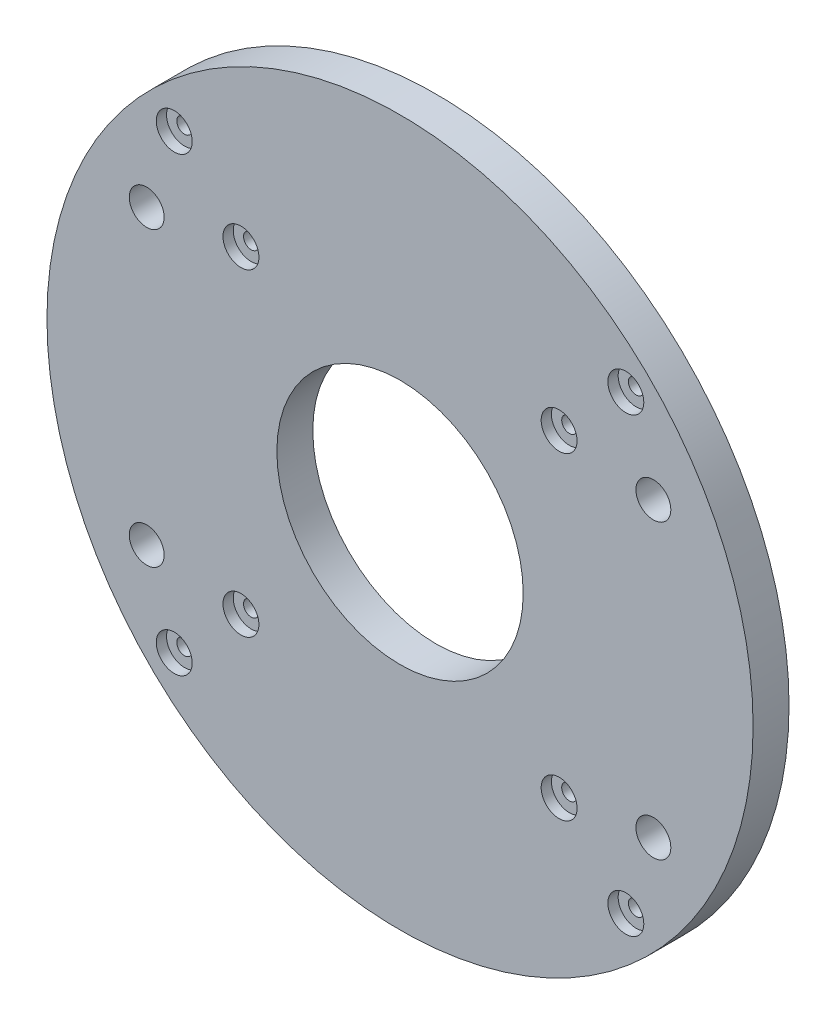
from build123d import *
from build123d.topology import SkipClean

# Parameters (mm, degrees)
EXTRUDE_1_DEPTH     = 3.5
EXTRUDE_START       = 3
SKETCH_2_R          = 1.7
EXTRUDE_2_DEPTH     = 3
SKETCH_3_R          = 0.75
CUT_EXTRUDE_1_DEPTH = 88.945086175
SKETCH_4_R          = 12
CUT_EXTRUDE_2_DEPTH = 88.945086175
CUT_EXTRUDE_START   = -1
SKETCH_5_R          = 1.75
SKETCH_5_R_2        = 0.75
CUT_EXTRUDE_4_DEPTH = 1
SKETCH_6_W          = 3
SKETCH_6_H          = 50
CUT_EXTRUDE_5_DEPTH = 100.398968375


with BuildPart() as part:
    # 草图1 → 凸台-拉伸1 (new body)
    with BuildSketch(Plane.XY):
        with BuildLine():
            ThreePointArc((31.968716166, 26.753538627), (7.644242894, 16.6780119), (-2.431283834, -7.646461373))
            ThreePointArc((-2.431283834, -7.646461373), (31.968716166, -42.046461373), (66.368716166, -7.646461373))
            ThreePointArc((66.368716166, -7.646461373), (56.293189439, 16.6780119), (31.968716166, 26.753538627))
        make_face()
        with BuildLine():
            ThreePointArc((7.286992159, 4.903538627), (8.986992159, 6.603538627), (7.286992159, 8.303538627))
            ThreePointArc((7.286992159, 8.303538627), (5.586992159, 6.603538627), (7.286992159, 4.903538627))
        make_face(mode=Mode.SUBTRACT)
        with BuildLine():
            ThreePointArc((56.650440174, 8.303538627), (54.950440174, 6.603538627), (56.650440174, 4.903538627))
            ThreePointArc((56.650440174, 4.903538627), (58.350440174, 6.603538627), (56.650440174, 8.303538627))
        make_face(mode=Mode.SUBTRACT)
        with BuildLine():
            ThreePointArc((7.286992159, -23.596461373), (8.986992159, -21.896461373), (7.286992159, -20.196461373))
            ThreePointArc((7.286992159, -20.196461373), (5.586992159, -21.896461373), (7.286992159, -23.596461373))
        make_face(mode=Mode.SUBTRACT)
        with BuildLine():
            ThreePointArc((56.650440174, -20.196461373), (54.950440174, -21.896461373), (56.650440174, -23.596461373))
            ThreePointArc((56.650440174, -23.596461373), (58.350440174, -21.896461373), (56.650440174, -20.196461373))
        make_face(mode=Mode.SUBTRACT)
    extrude(amount=EXTRUDE_1_DEPTH)

    # 草图2 → 凸台-拉伸2 (add)
    # profile 1 of 3: a face of its own
    with SkipClean():  # the faces are left unmerged after this step: merging them gives an invalid solid
        with BuildSketch(Plane(origin=(0, 0, 0), x_dir=(-1, 0, 0), z_dir=(0, 0, -1)).offset(EXTRUDE_START)):
            with BuildLine():
                ThreePointArc((-55.598358567, 17.353538627), (-66.368716166, -7.646461373), (-55.598358567, -32.646461373))
                Line((-55.598358567, -32.646461373), (-8.339073765, -32.646461373))
                ThreePointArc((-8.339073765, -32.646461373), (-0.375839607, -21.257124498), (2.431283834, -7.646461373))
                ThreePointArc((2.431283834, -7.646461373), (-0.375839607, 5.964201752), (-8.339073765, 17.353538627))
                Line((-8.339073765, 17.353538627), (-55.598358567, 17.353538627))
            make_face()
            with Locations((-56.650440174, -21.896461373)):
                Circle(SKETCH_2_R, mode=Mode.SUBTRACT)
            with Locations((-7.286992159, -21.896461373)):
                Circle(SKETCH_2_R, mode=Mode.SUBTRACT)
            with Locations((-56.650440174, 6.603538627)):
                Circle(SKETCH_2_R, mode=Mode.SUBTRACT)
            with Locations((-7.286992159, 6.603538627)):
                Circle(SKETCH_2_R, mode=Mode.SUBTRACT)
        # profile 2 of 3: a face of its own
        with BuildSketch(Plane(origin=(0, 0, 0), x_dir=(-1, 0, 0), z_dir=(0, 0, -1)).offset(EXTRUDE_START)):
            with BuildLine():
                Line((-76.968716166, 17.353538627), (-76.968716166, -32.646461373))
                Line((-76.968716166, -32.646461373), (-55.598358567, -32.646461373))
                ThreePointArc((-55.598358567, -32.646461373), (-66.368716166, -7.646461373), (-55.598358567, 17.353538627))
                Line((-55.598358567, 17.353538627), (-76.968716166, 17.353538627))
            make_face()
        # profile 3 of 3: a face of its own
        with BuildSketch(Plane(origin=(0, 0, 0), x_dir=(-1, 0, 0), z_dir=(0, 0, -1)).offset(EXTRUDE_START)):
            with BuildLine():
                ThreePointArc((2.431283834, -7.646461373), (-0.375839607, -21.257124498), (-8.339073765, -32.646461373))
                Line((-8.339073765, -32.646461373), (13.031283834, -32.646461373))
                Line((13.031283834, -32.646461373), (13.031283834, 17.353538627))
                Line((13.031283834, 17.353538627), (-8.339073765, 17.353538627))
                ThreePointArc((-8.339073765, 17.353538627), (-0.375839607, 5.964201752), (2.431283834, -7.646461373))
            make_face()
        extrude(amount=-EXTRUDE_2_DEPTH)

    # 草图3 → 切除-拉伸1 (cut, through all)
    with SkipClean():  # the faces are left unmerged after this step: merging them gives an invalid solid
        with BuildSketch(Plane(origin=(0, 0, -3), x_dir=(-1, 0, 0), z_dir=(0, 0, -1))):
            with Locations((-47.468716166, 7.853538627)):
                Circle(SKETCH_3_R)
            with Locations(Location((-47.468716166, -23.146461373, 0), (0, 0, 180))):
                Circle(SKETCH_3_R)
            with Locations(Location((-16.468716166, 7.853538627, 0), (0, 0, 180))):
                Circle(SKETCH_3_R)
            with Locations((-16.468716166, -23.146461373)):
                Circle(SKETCH_3_R)
            with Locations((-53.968716166, 14.353538627)):
                Circle(SKETCH_3_R)
            with Locations(Location((-53.968716166, -29.646461373, 0), (0, 0, 180))):
                Circle(SKETCH_3_R)
            with Locations((-9.968716166, -29.646461373)):
                Circle(SKETCH_3_R)
            with Locations(Location((-9.968716166, 14.353538627, 0), (0, 0, 180))):
                Circle(SKETCH_3_R)
        extrude(amount=-CUT_EXTRUDE_1_DEPTH, mode=Mode.SUBTRACT)

    # 草图4 → 切除-拉伸2 (cut, through all)
    with SkipClean():  # the faces are left unmerged after this step: merging them gives an invalid solid
        with BuildSketch(Plane.XY.offset(3.5)):
            with Locations((31.968716166, -7.646461373)):
                Circle(SKETCH_4_R)
        extrude(amount=-CUT_EXTRUDE_2_DEPTH, mode=Mode.SUBTRACT)

    # 草图5 → 切除-拉伸4 (cut)
    # profile 1 of 8: a face of its own
    with SkipClean():  # the faces are left unmerged after this step: merging them gives an invalid solid
        with BuildSketch(Plane.XY.offset(3.5).offset(CUT_EXTRUDE_START)):
            with Locations((9.968716166, 14.353538627)):
                Circle(SKETCH_5_R)
            with Locations((9.968716166, 14.353538627)):
                Circle(SKETCH_5_R_2, mode=Mode.SUBTRACT)
        # profile 2 of 8: a face of its own
        with BuildSketch(Plane.XY.offset(3.5).offset(CUT_EXTRUDE_START)):
            with Locations((16.468716166, 7.853538627)):
                Circle(SKETCH_5_R)
            with Locations((16.468716166, 7.853538627)):
                Circle(SKETCH_5_R_2, mode=Mode.SUBTRACT)
        # profile 3 of 8: a face of its own
        with BuildSketch(Plane.XY.offset(3.5).offset(CUT_EXTRUDE_START)):
            with Locations((47.468716166, 7.853538627)):
                Circle(SKETCH_5_R)
            with Locations(Location((47.468716166, 7.853538627, 0), (0, 0, 180))):
                Circle(SKETCH_5_R_2, mode=Mode.SUBTRACT)
        # profile 4 of 8: a face of its own
        with BuildSketch(Plane.XY.offset(3.5).offset(CUT_EXTRUDE_START)):
            with Locations((53.968716166, 14.353538627)):
                Circle(SKETCH_5_R)
            with Locations(Location((53.968716166, 14.353538627, 0), (0, 0, 180))):
                Circle(SKETCH_5_R_2, mode=Mode.SUBTRACT)
        # profile 5 of 8: a face of its own
        with BuildSketch(Plane.XY.offset(3.5).offset(CUT_EXTRUDE_START)):
            with Locations((47.468716166, -23.146461373)):
                Circle(SKETCH_5_R)
            with Locations((47.468716166, -23.146461373)):
                Circle(SKETCH_5_R_2, mode=Mode.SUBTRACT)
        # profile 6 of 8: a face of its own
        with BuildSketch(Plane.XY.offset(3.5).offset(CUT_EXTRUDE_START)):
            with Locations((16.468716166, -23.146461373)):
                Circle(SKETCH_5_R)
            with Locations(Location((16.468716166, -23.146461373, 0), (0, 0, 180))):
                Circle(SKETCH_5_R_2, mode=Mode.SUBTRACT)
        # profile 7 of 8: a face of its own
        with BuildSketch(Plane.XY.offset(3.5).offset(CUT_EXTRUDE_START)):
            with Locations((9.968716166, -29.646461373)):
                Circle(SKETCH_5_R)
            with Locations(Location((9.968716166, -29.646461373, 0), (0, 0, 180))):
                Circle(SKETCH_5_R_2, mode=Mode.SUBTRACT)
        # profile 8 of 8: a face of its own
        with BuildSketch(Plane.XY.offset(3.5).offset(CUT_EXTRUDE_START)):
            with Locations((53.968716166, -29.646461373)):
                Circle(SKETCH_5_R)
            with Locations((53.968716166, -29.646461373)):
                Circle(SKETCH_5_R_2, mode=Mode.SUBTRACT)
        extrude(amount=CUT_EXTRUDE_4_DEPTH, mode=Mode.SUBTRACT)

    # 草图6 → 切除-拉伸5 (cut, through all)
    with BuildSketch(Plane(origin=(76.968716166, 0, 0), x_dir=(0, 0, -1), z_dir=(1, 0, 0))):
        with Locations((1.5, -7.646461373)):
            Rectangle(SKETCH_6_W, SKETCH_6_H)
    extrude(amount=-CUT_EXTRUDE_5_DEPTH, mode=Mode.SUBTRACT)


solid = part.part
